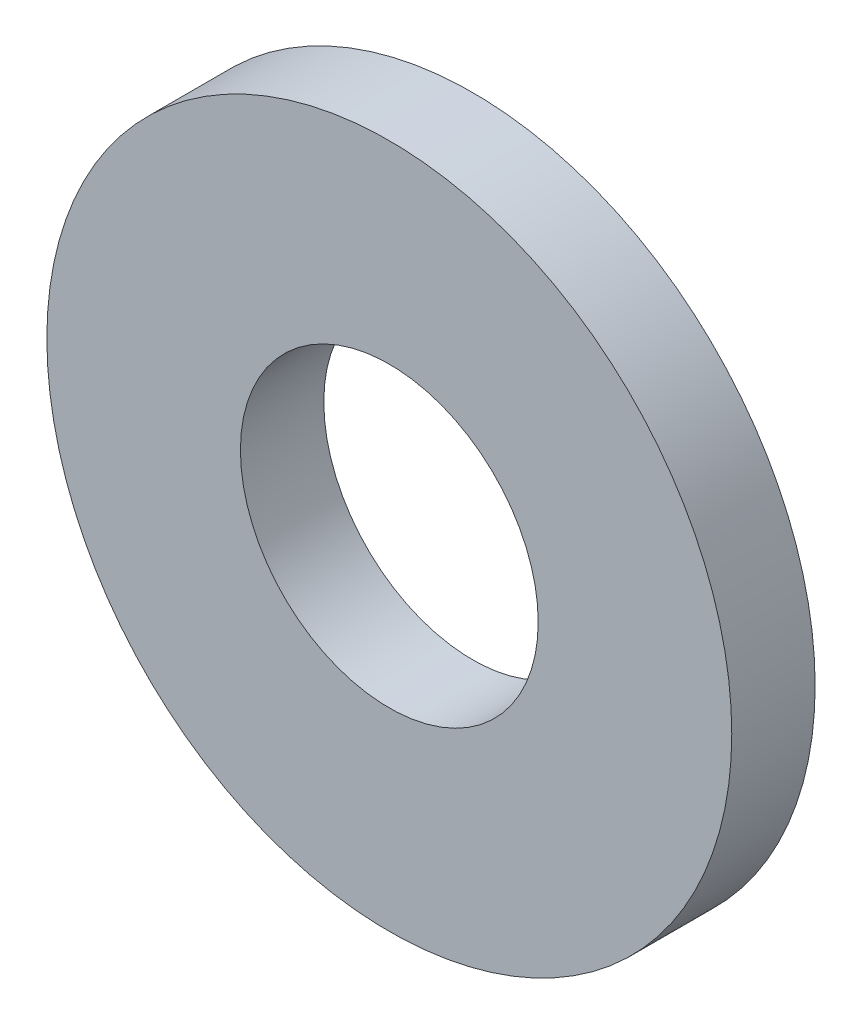
from build123d import *

# Parameters (mm, degrees)
ESQUISSE1_R        = 2.875
ESQUISSE1_R_2      = 1.25
BOSS_EXTRU_1_DEPTH = 0.7


with BuildPart() as part:
    # Esquisse1 → Boss.-Extru.1 (new body)
    with BuildSketch(Plane.XY):
        Circle(ESQUISSE1_R)
        Circle(ESQUISSE1_R_2, mode=Mode.SUBTRACT)
    extrude(amount=BOSS_EXTRU_1_DEPTH)


solid = part.part
